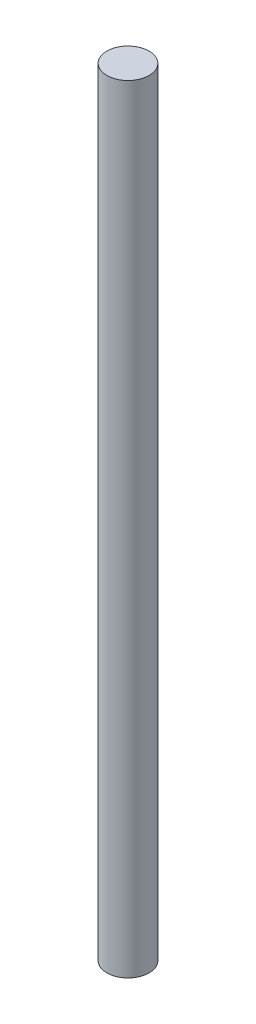
from build123d import *

# Parameters (mm, degrees)
SKETCH1_R           = 4
BOSS_EXTRUDE1_DEPTH = 147.09


with BuildPart() as part:
    # Sketch1 → Boss-Extrude1 (new body)
    with BuildSketch(Plane(origin=(0, 0, 0), x_dir=(1, 0, 0), z_dir=(0, 1, 0))):
        with Locations(Location((-5.326822835, 0, 0), (0, 0, 270))):
            Circle(SKETCH1_R)
    extrude(amount=BOSS_EXTRUDE1_DEPTH)


solid = part.part
